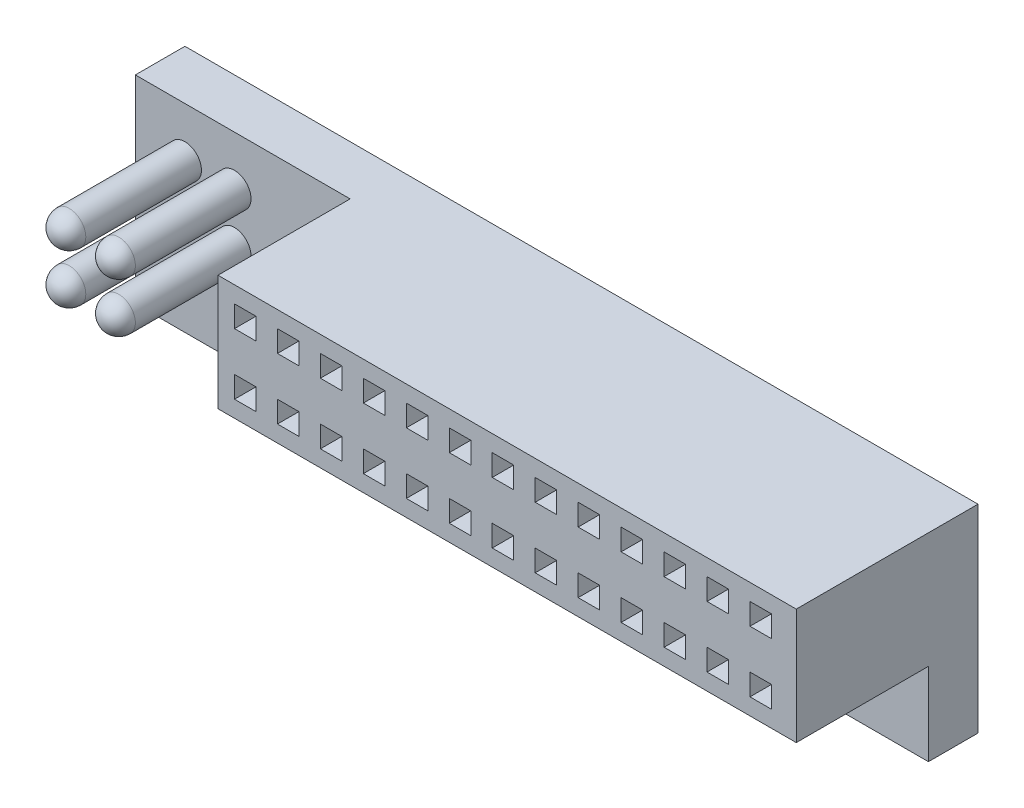
from build123d import *

# Parameters (mm, degrees)
SKETCH1_W           = 48
SKETCH1_H           = 12
BOSS_EXTRUDE1_DEPTH = 3
SKETCH2_W           = 35
SKETCH2_H           = 7
SKETCH2_W_2         = 1.3
SKETCH2_H_2         = 1.3
BOSS_EXTRUDE2_DEPTH = 8
SKETCH3_R           = 1
BOSS_EXTRUDE3_DEPTH = 8
FILLET1_R           = 1


with BuildPart() as part:
    # Sketch1 → Boss-Extrude1 (new body)
    with BuildSketch(Plane.XY):
        with Locations((24, 6)):
            Rectangle(SKETCH1_W, SKETCH1_H)
    extrude(amount=BOSS_EXTRUDE1_DEPTH)

    # Sketch2 → Boss-Extrude2 (add)
    with BuildSketch(Plane.XY.offset(3)):
        with Locations((30.5, 8.5)):
            Rectangle(SKETCH2_W, SKETCH2_H)
        with Locations((17.25, 10.35)):
            Rectangle(SKETCH2_W_2, SKETCH2_H_2, mode=Mode.SUBTRACT)
        with Locations((14.65, 10.35)):
            Rectangle(SKETCH2_W_2, SKETCH2_H_2, mode=Mode.SUBTRACT)
        with Locations((14.65, 6.65)):
            Rectangle(SKETCH2_W_2, SKETCH2_H_2, mode=Mode.SUBTRACT)
        with Locations((17.25, 6.65)):
            Rectangle(SKETCH2_W_2, SKETCH2_H_2, mode=Mode.SUBTRACT)
        with Locations((19.85, 10.35)):
            Rectangle(SKETCH2_W_2, SKETCH2_H_2, mode=Mode.SUBTRACT)
        with Locations((19.85, 6.65)):
            Rectangle(SKETCH2_W_2, SKETCH2_H_2, mode=Mode.SUBTRACT)
        with Locations((22.45, 10.35)):
            Rectangle(SKETCH2_W_2, SKETCH2_H_2, mode=Mode.SUBTRACT)
        with Locations((22.45, 6.65)):
            Rectangle(SKETCH2_W_2, SKETCH2_H_2, mode=Mode.SUBTRACT)
        with Locations((25.05, 10.35)):
            Rectangle(SKETCH2_W_2, SKETCH2_H_2, mode=Mode.SUBTRACT)
        with Locations((25.05, 6.65)):
            Rectangle(SKETCH2_W_2, SKETCH2_H_2, mode=Mode.SUBTRACT)
        with Locations((27.65, 10.35)):
            Rectangle(SKETCH2_W_2, SKETCH2_H_2, mode=Mode.SUBTRACT)
        with Locations((27.65, 6.65)):
            Rectangle(SKETCH2_W_2, SKETCH2_H_2, mode=Mode.SUBTRACT)
        with Locations((30.25, 10.35)):
            Rectangle(SKETCH2_W_2, SKETCH2_H_2, mode=Mode.SUBTRACT)
        with Locations((30.25, 6.65)):
            Rectangle(SKETCH2_W_2, SKETCH2_H_2, mode=Mode.SUBTRACT)
        with Locations((32.85, 10.35)):
            Rectangle(SKETCH2_W_2, SKETCH2_H_2, mode=Mode.SUBTRACT)
        with Locations((32.85, 6.65)):
            Rectangle(SKETCH2_W_2, SKETCH2_H_2, mode=Mode.SUBTRACT)
        with Locations((35.45, 10.35)):
            Rectangle(SKETCH2_W_2, SKETCH2_H_2, mode=Mode.SUBTRACT)
        with Locations((35.45, 6.65)):
            Rectangle(SKETCH2_W_2, SKETCH2_H_2, mode=Mode.SUBTRACT)
        with Locations((38.05, 10.35)):
            Rectangle(SKETCH2_W_2, SKETCH2_H_2, mode=Mode.SUBTRACT)
        with Locations((38.05, 6.65)):
            Rectangle(SKETCH2_W_2, SKETCH2_H_2, mode=Mode.SUBTRACT)
        with Locations((40.65, 10.35)):
            Rectangle(SKETCH2_W_2, SKETCH2_H_2, mode=Mode.SUBTRACT)
        with Locations((40.65, 6.65)):
            Rectangle(SKETCH2_W_2, SKETCH2_H_2, mode=Mode.SUBTRACT)
        with Locations((43.25, 10.35)):
            Rectangle(SKETCH2_W_2, SKETCH2_H_2, mode=Mode.SUBTRACT)
        with Locations((43.25, 6.65)):
            Rectangle(SKETCH2_W_2, SKETCH2_H_2, mode=Mode.SUBTRACT)
        with Locations((45.85, 10.35)):
            Rectangle(SKETCH2_W_2, SKETCH2_H_2, mode=Mode.SUBTRACT)
        with Locations((45.85, 6.65)):
            Rectangle(SKETCH2_W_2, SKETCH2_H_2, mode=Mode.SUBTRACT)
    extrude(amount=BOSS_EXTRUDE2_DEPTH)

    # Sketch3 → Boss-Extrude3 (add)
    with BuildSketch(Plane.XY.offset(3)):
        with Locations(Location((3, 9, 0), (0, 0, 180))):
            Circle(SKETCH3_R)
        with Locations(Location((3, 6, 0), (0, 0, 180))):
            Circle(SKETCH3_R)
        with Locations(Location((6, 9, 0), (0, 0, 180))):
            Circle(SKETCH3_R)
        with Locations(Location((6, 6, 0), (0, 0, 180))):
            Circle(SKETCH3_R)
    extrude(amount=BOSS_EXTRUDE3_DEPTH)

    # Fillet1
    fillet1_edges = [part.edges().sort_by_distance(p)[0] for p in [
        (4, 9, 11),
        (4, 6, 11),
        (7, 9, 11),
        (7, 6, 11),
    ]]
    fillet(fillet1_edges, radius=FILLET1_R)


solid = part.part
